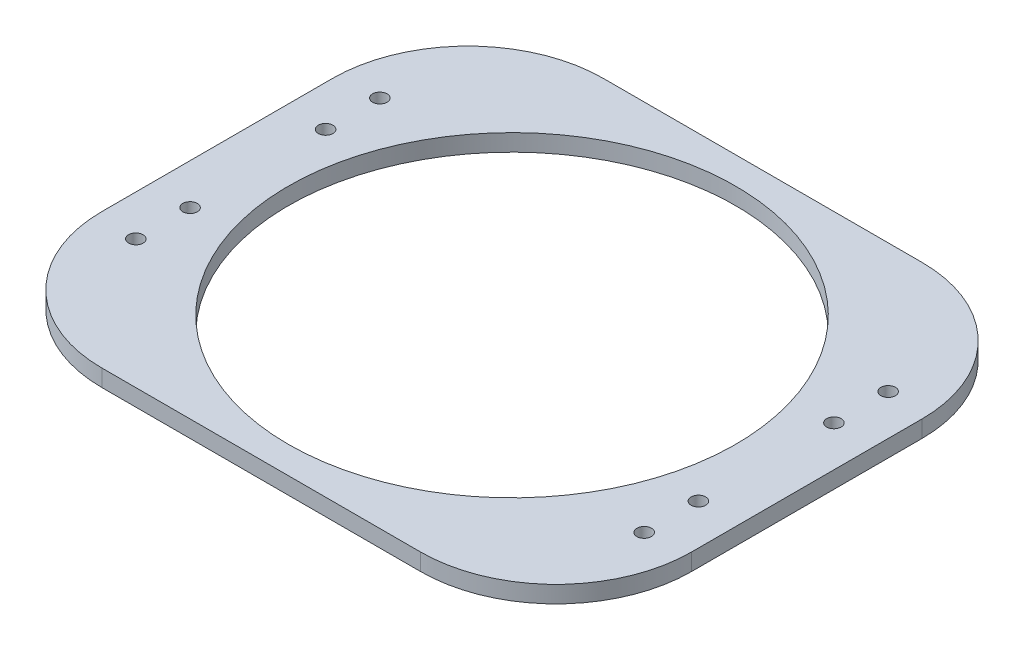
from build123d import *

# Parameters (mm, degrees)
SKETCH1_W           = 174
SKETCH1_H           = 148
SKETCH1_R           = 66
SKETCH1_R_2         = 2.15
BOSS_EXTRUDE1_DEPTH = 5
FILLET1_R           = 40


with BuildPart() as part:
    # Sketch1 → Boss-Extrude1 (new body)
    with BuildSketch(Plane(origin=(0, 0, 0), x_dir=(1, 0, 0), z_dir=(0, 1, 0))):
        Rectangle(SKETCH1_W, SKETCH1_H)
        with Locations(Location((0, 0, 0), (0, 0, 270))):
            Circle(SKETCH1_R, mode=Mode.SUBTRACT)
        with Locations(Location((75, 36, 0), (0, 0, 270))):
            Circle(SKETCH1_R_2, mode=Mode.SUBTRACT)
        with Locations(Location((75, 20, 0), (0, 0, 270))):
            Circle(SKETCH1_R_2, mode=Mode.SUBTRACT)
        with Locations(Location((75, -20, 0), (0, 0, 90))):
            Circle(SKETCH1_R_2, mode=Mode.SUBTRACT)
        with Locations(Location((75, -36, 0), (0, 0, 90))):
            Circle(SKETCH1_R_2, mode=Mode.SUBTRACT)
        with Locations(Location((-75, -36, 0), (0, 0, 270))):
            Circle(SKETCH1_R_2, mode=Mode.SUBTRACT)
        with Locations(Location((-75, -20, 0), (0, 0, 270))):
            Circle(SKETCH1_R_2, mode=Mode.SUBTRACT)
        with Locations(Location((-75, 20, 0), (0, 0, 90))):
            Circle(SKETCH1_R_2, mode=Mode.SUBTRACT)
        with Locations(Location((-75, 36, 0), (0, 0, 90))):
            Circle(SKETCH1_R_2, mode=Mode.SUBTRACT)
    extrude(amount=BOSS_EXTRUDE1_DEPTH)

    # Fillet1
    fillet1_edges = [part.edges().sort_by_distance(p)[0] for p in [
        (-87, 2.5, -74),
        (87, 2.5, -74),
        (87, 2.5, 74),
        (-87, 2.5, 74),
    ]]
    fillet(fillet1_edges, radius=FILLET1_R)


solid = part.part
